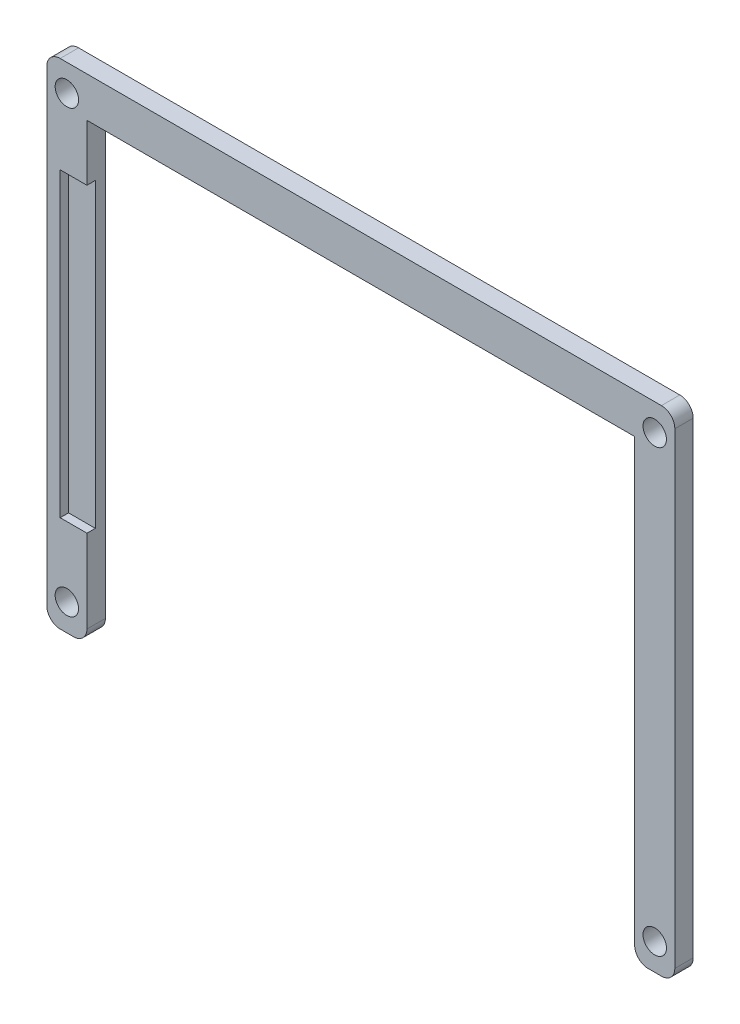
from build123d import *

# Parameters (mm, degrees)
SKETCH1_R           = 1.75
BOSS_EXTRUDE1_DEPTH = 2.75
SKETCH2_W           = 4
SKETCH2_H           = 45
CUT_EXTRUDE1_DEPTH  = 1.25


with BuildPart() as part:
    # Sketch1 → Boss-Extrude1 (new body)
    with BuildSketch(Plane.XY):
        with BuildLine():
            Line((-41.592117096, -107.975551573), (-41.592117096, -113.323938617))
            ThreePointArc((-41.592117096, -113.323938617), (-42.177903534, -114.73815218), (-43.592117096, -115.323938617))
            Line((-43.592117096, -115.323938617), (-45.592117096, -115.323938617))
            ThreePointArc((-45.592117096, -115.323938617), (-47.006330659, -114.73815218), (-47.592117096, -113.323938617))
            Line((-47.592117096, -113.323938617), (-47.592117096, -43.523080591))
            ThreePointArc((-47.592117096, -43.523080591), (-47.006330659, -42.108867028), (-45.592117096, -41.523080591))
            Line((-45.592117096, -41.523080591), (44.207882904, -41.523080591))
            ThreePointArc((44.207882904, -41.523080591), (45.622096466, -42.108867028), (46.207882904, -43.523080591))
            Line((46.207882904, -43.523080591), (46.207882904, -113.323938617))
            ThreePointArc((46.207882904, -113.323938617), (45.622096466, -114.73815218), (44.207882904, -115.323938617))
            Line((44.207882904, -115.323938617), (42.207882904, -115.323938617))
            ThreePointArc((42.207882904, -115.323938617), (40.793669341, -114.73815218), (40.207882904, -113.323938617))
            Line((40.207882904, -113.323938617), (40.207882904, -107.975551573))
            Line((40.207882904, -107.975551573), (40.207882904, -47.523080591))
            Line((40.207882904, -47.523080591), (-41.592117096, -47.523080591))
            Line((-41.592117096, -47.523080591), (-41.592117096, -107.975551573))
        make_face()
        with Locations((-44.592117096, -45.523938617)):
            Circle(SKETCH1_R, mode=Mode.SUBTRACT)
        with Locations((43.207882904, -45.523938617)):
            Circle(SKETCH1_R, mode=Mode.SUBTRACT)
        with Locations((43.207882904, -111.323938617)):
            Circle(SKETCH1_R, mode=Mode.SUBTRACT)
        with Locations((-44.592117096, -111.323938617)):
            Circle(SKETCH1_R, mode=Mode.SUBTRACT)
    extrude(amount=BOSS_EXTRUDE1_DEPTH)

    # Sketch2 → Cut-Extrude1 (cut)
    with BuildSketch(Plane.XY.offset(2.75)):
        with Locations((-43.592117096, -78.423509604)):
            Rectangle(SKETCH2_W, SKETCH2_H)
    extrude(amount=-CUT_EXTRUDE1_DEPTH, mode=Mode.SUBTRACT)


solid = part.part
